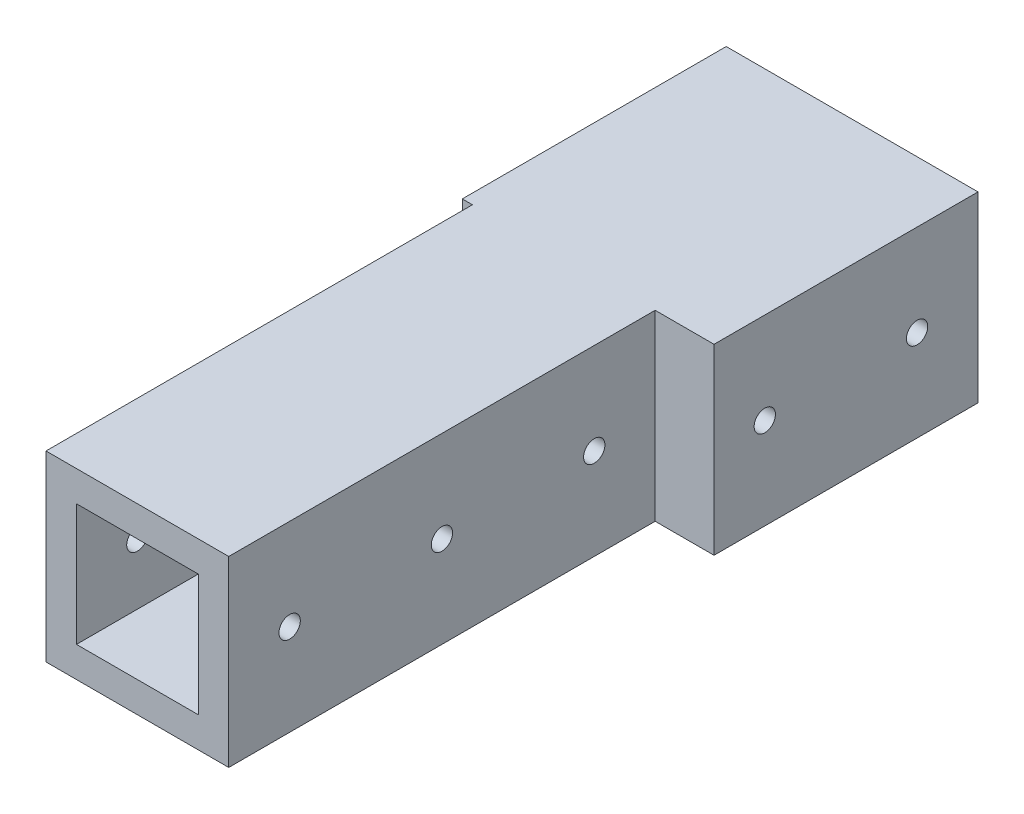
from build123d import *

# Parameters (mm, degrees)
SKETCH_1_W          = 18
SKETCH_1_H          = 18
SKETCH_1_W_2        = 12
SKETCH_1_H_2        = 12
EXTRUDE_1_DEPTH     = 68
SKETCH_2_R          = 1.05
CUT_EXTRUDE_1_DEPTH = 32
SKETCH_3_W          = 26
SKETCH_3_H          = 18
EXTRUDE_2_DEPTH     = 5.8
SKETCH_4_W          = 26
SKETCH_4_H          = 18
EXTRUDE_3_DEPTH     = 1
SKETCH_5_R          = 1.05
CUT_EXTRUDE_2_DEPTH = 41


with BuildPart() as part:
    # 草图1 → 凸台-拉伸1 (new body)
    with BuildSketch(Plane.XY):
        with Locations((9, -9)):
            Rectangle(SKETCH_1_W, SKETCH_1_H)
        with Locations((9, -9)):
            Rectangle(SKETCH_1_W_2, SKETCH_1_H_2, mode=Mode.SUBTRACT)
    extrude(amount=EXTRUDE_1_DEPTH)

    # 草图2 → 切除-拉伸1 (cut)
    with BuildSketch(Plane(origin=(18, 0, 0), x_dir=(0, 0, -1), z_dir=(1, 0, 0))):
        with Locations((-62, -9)):
            Circle(SKETCH_2_R)
        with Locations((-47, -9)):
            Circle(SKETCH_2_R)
        with Locations((-32, -9)):
            Circle(SKETCH_2_R)
        with Locations((-6, -9)):
            Circle(SKETCH_2_R)
        with Locations((-21, -9)):
            Circle(SKETCH_2_R)
    extrude(amount=-CUT_EXTRUDE_1_DEPTH, mode=Mode.SUBTRACT)

    # 草图3 → 凸台-拉伸2 (add)
    with BuildSketch(Plane(origin=(18, 0, 0), x_dir=(0, 0, -1), z_dir=(1, 0, 0))):
        with Locations((-13, -9)):
            Rectangle(SKETCH_3_W, SKETCH_3_H)
    extrude(amount=EXTRUDE_2_DEPTH)

    # 草图4 → 凸台-拉伸3 (add)
    with BuildSketch(Plane.ZY):
        with Locations((13, -9)):
            Rectangle(SKETCH_4_W, SKETCH_4_H)
    extrude(amount=EXTRUDE_3_DEPTH)

    # 草图5 → 切除-拉伸2 (cut)
    with BuildSketch(Plane(origin=(23.8, 0, 0), x_dir=(0, 0, -1), z_dir=(1, 0, 0))):
        with Locations((-6, -9)):
            Circle(SKETCH_5_R)
        with Locations((-21, -9)):
            Circle(SKETCH_5_R)
    extrude(amount=-CUT_EXTRUDE_2_DEPTH, mode=Mode.SUBTRACT)


solid = part.part
